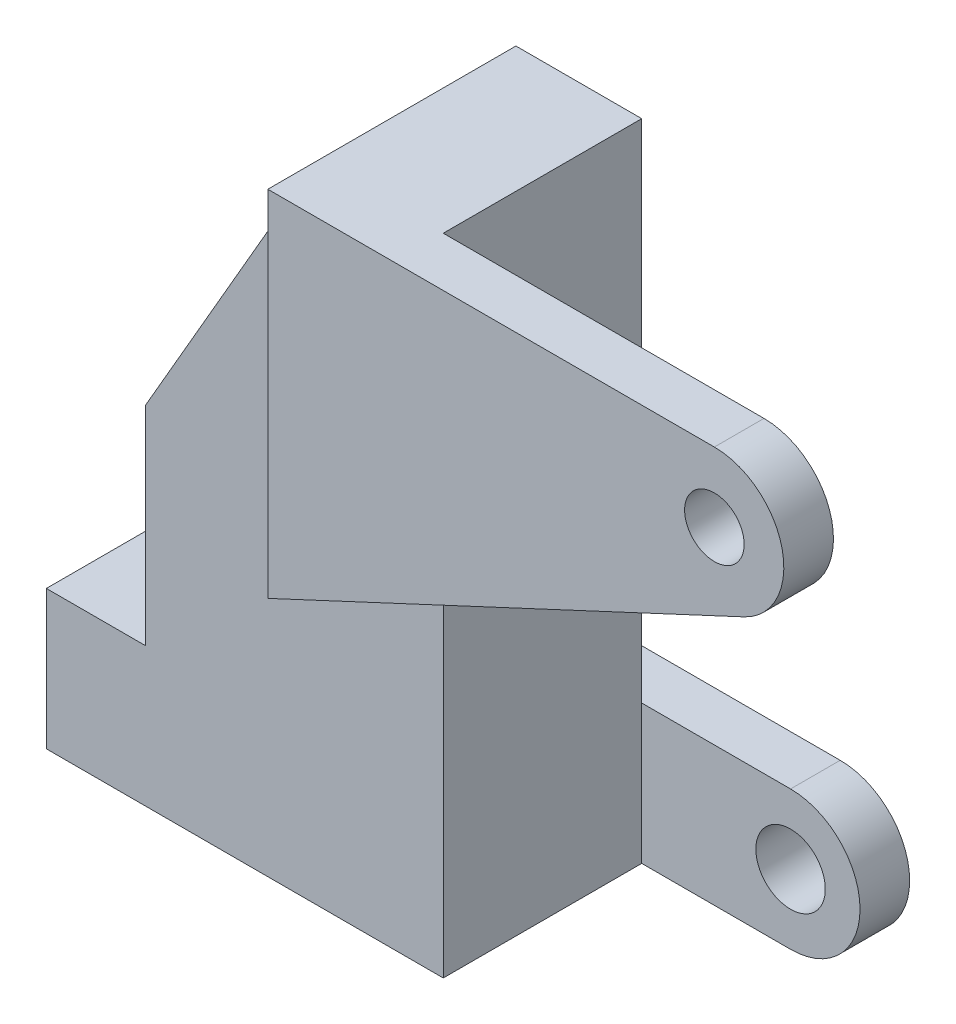
from build123d import *

# Parameters (mm, degrees)
BOSS_EXTRUDE1_DEPTH = 20
SKETCH2_R           = 3
BOSS_EXTRUDE2_DEPTH = 5
SKETCH3_R           = 3.5
BOSS_EXTRUDE3_DEPTH = 5


with BuildPart() as part:
    # Sketch1 → Boss-Extrude1 (new body)
    with BuildSketch(Plane.XY):
        Polygon((0, 0), (0, 14), (10, 14), (10, 35), (27.320508076, 65), (40, 65), (40, 0), align=None)
    extrude(amount=BOSS_EXTRUDE1_DEPTH)

    # Sketch2 → Boss-Extrude2 (add)
    with BuildSketch(Plane.XY.offset(20)):
        with BuildLine():
            Line((27.320508076, 65), (27.320508076, 29.29250995))
            Line((27.320508076, 29.29250995), (75.278835908, 51.655845491))
            ThreePointArc((75.278835908, 51.655845491), (79.154580126, 59.515077298), (72.320508076, 65))
            Line((72.320508076, 65), (27.320508076, 65))
        make_face()
        with Locations((72.320508076, 58)):
            Circle(SKETCH2_R, mode=Mode.SUBTRACT)
    extrude(amount=BOSS_EXTRUDE2_DEPTH)

    # Sketch3 → Boss-Extrude3 (add)
    with BuildSketch(Plane(origin=(0, 0, 0), x_dir=(-1, 0, 0), z_dir=(0, 0, -1))):
        with BuildLine():
            Line((-10, 14), (-10, 0))
            Line((-10, 0), (-55, 0))
            ThreePointArc((-55, 0), (-62, 7), (-55, 14))
            Line((-55, 14), (-10, 14))
        make_face()
        with Locations((-55, 7)):
            Circle(SKETCH3_R, mode=Mode.SUBTRACT)
    extrude(amount=BOSS_EXTRUDE3_DEPTH)


solid = part.part
